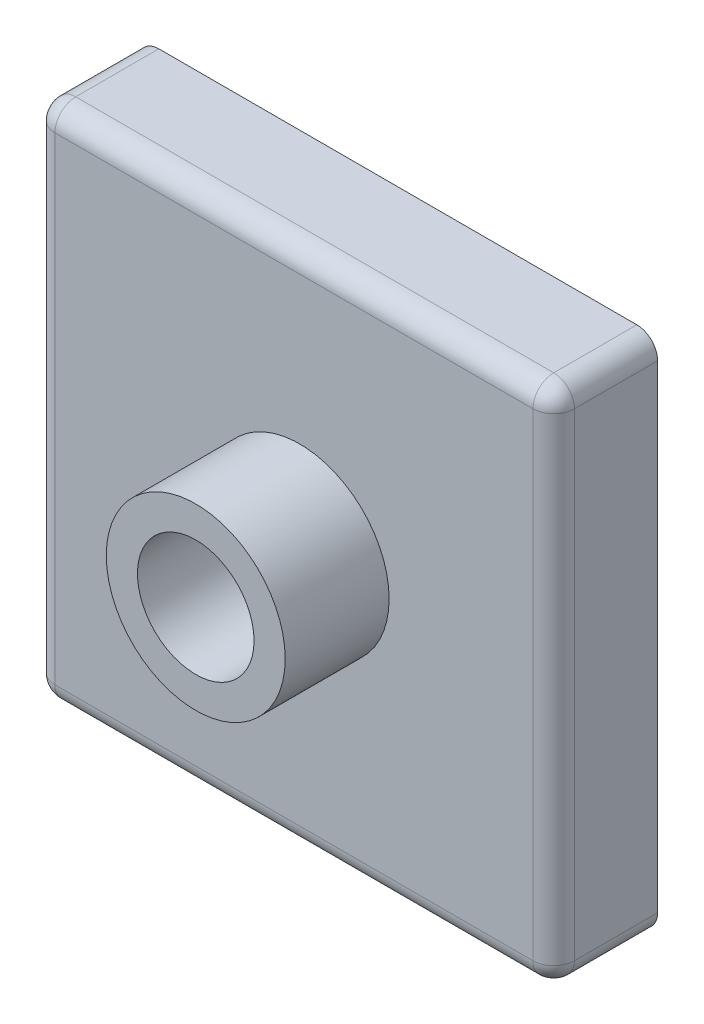
from build123d import *

# Parameters (mm, degrees)
BOSS_EXTRUDE1_DEPTH = 254
SKETCH2_R           = 218.69407086262316
BOSS_EXTRUDE2_DEPTH = 254
FILLET2_R           = 50.8
FILLET3_R           = 50.8
FILLET4_R           = 50.8
FILLET5_R           = 50.8
SKETCH4_R           = 142.49407086262323
CUT_EXTRUDE13_DEPTH = 1867.5111840007871
SHELL4_T            = -76.2


with BuildPart() as part:
    # Sketch1 → Boss-Extrude1 (new body)
    with BuildSketch(Plane.XY):
        Polygon((0, 0), (1270, 0), (1270.0000000000002, -1270), (1.5553e-13, -1270), align=None)
    extrude(amount=BOSS_EXTRUDE1_DEPTH)

    # Sketch2 → Boss-Extrude2 (add)
    with BuildSketch(Plane(origin=(15.756060209551226, -33.262793775725605, 254.0000000000191), x_dir=(1, 0, 0), z_dir=(0, 0, 1))):
        with Locations((633.2493266433831, -595.6098494761216)):
            Circle(SKETCH2_R)
    extrude(amount=BOSS_EXTRUDE2_DEPTH)

    # Fillet2
    fillet2_edges = [part.edges().sort_by_distance(p)[0] for p in [
        (1270, -635, 254),
    ]]
    fillet(fillet2_edges, radius=FILLET2_R)

    # Fillet3
    fillet3_edges = [part.edges().sort_by_distance(p)[0] for p in [
        (609.6, 0, 254),
        (1270, 0, 101.60000000000001),
        (1255.1210244842766, 6.43e-15, 239.12102448427663),
    ]]
    fillet(fillet3_edges, radius=FILLET3_R)

    # Fillet4
    fillet4_edges = [part.edges().sort_by_distance(p)[0] for p in [
        (1270.0000000000002, -1270, 101.60000000000001),
        (1255.1210244842769, -1270, 239.12102448427663),
        (609.6000000000003, -1270, 254),
    ]]
    fillet(fillet4_edges, radius=FILLET4_R)

    # Fillet5
    fillet5_edges = [part.edges().sort_by_distance(p)[0] for p in [
        (0, 0, 101.60000000000001),
        (7.777e-14, -635, 254),
        (6.22e-15, -14.878975515723361, 239.12102448427663),
        (1.5553e-13, -1270, 101.60000000000001),
        (2.2737e-13, -1255.1210244842766, 239.12102448427663),
    ]]
    fillet(fillet5_edges, radius=FILLET5_R)

    # Sketch4 → Cut-Extrude13 (cut, through all)
    with BuildSketch(Plane.XY.offset(508.0000000000191)):
        with Locations((649.0053868529344, -628.8726432518471)):
            Circle(SKETCH4_R)
    extrude(amount=-CUT_EXTRUDE13_DEPTH, mode=Mode.SUBTRACT)

    # Shell4
    shell4_openings = [part.faces().sort_by_distance(p)[0] for p in [
        (635, -1252.039487758, 0),
    ]]
    offset(amount=SHELL4_T, openings=shell4_openings, kind=Kind.INTERSECTION)


solid = part.part
